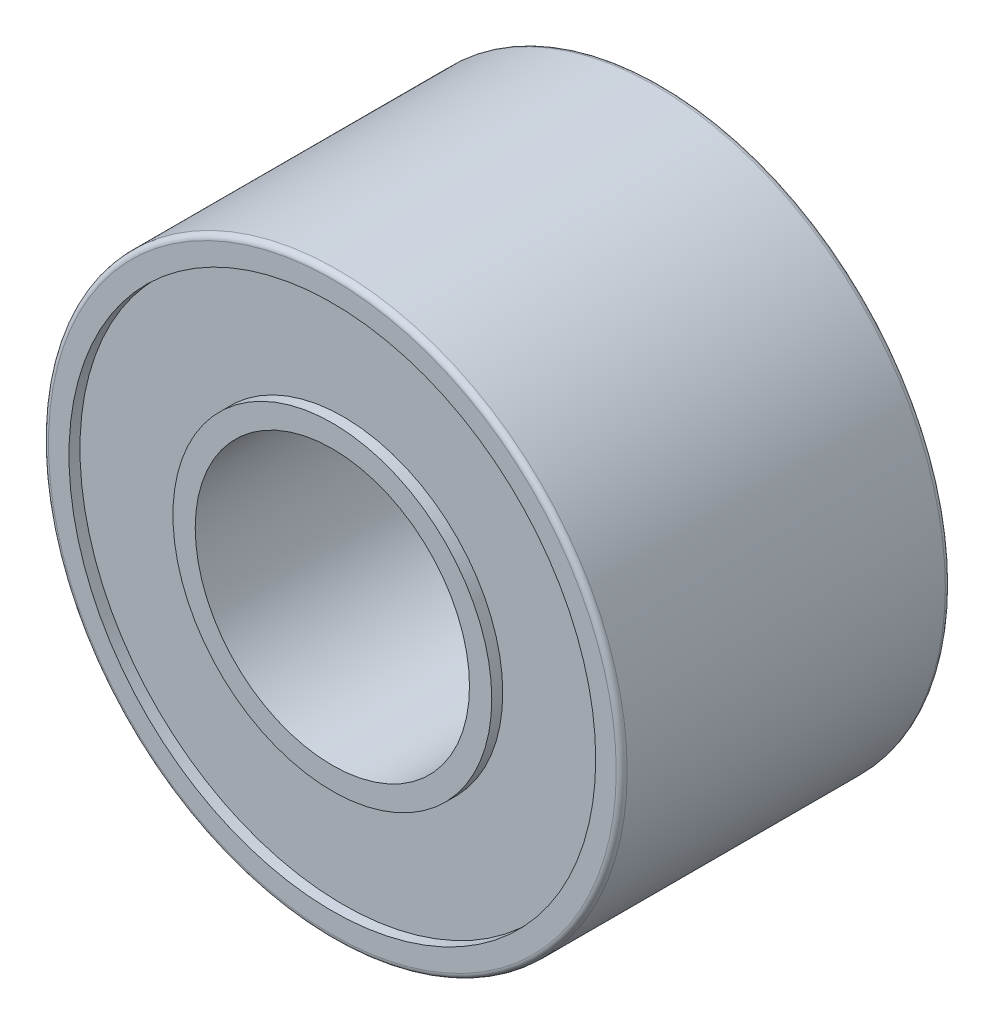
from build123d import *

# Parameters (mm, degrees)
SKETCH1_R           = 10.55
SKETCH1_R_2         = 5
BOSS_EXTRUDE1_DEPTH = 6
FILLET1_R           = 0.2
SKETCH3_R           = 9.602296017
SKETCH3_R_2         = 5.812916565
CUT_EXTRUDE1_DEPTH  = 0.4


with BuildPart() as part:
    # Sketch1 → Boss-Extrude1 (new, symmetric)
    with BuildSketch(Plane.XY):
        Circle(SKETCH1_R)
        Circle(SKETCH1_R_2, mode=Mode.SUBTRACT)
    extrude(amount=BOSS_EXTRUDE1_DEPTH, both=True)

    # Fillet1
    fillet1_edges = [part.edges().sort_by_distance(p)[0] for p in [
        (-10.55, 0, -6),
        (-10.55, 0, 6),
    ]]
    fillet(fillet1_edges, radius=FILLET1_R)

    # Sketch3 → Cut-Extrude1 (cut)
    with BuildSketch(Plane.XY.offset(6)):
        Circle(SKETCH3_R)
        Circle(SKETCH3_R_2, mode=Mode.SUBTRACT)
    cut_extrude1 = extrude(amount=-CUT_EXTRUDE1_DEPTH, mode=Mode.SUBTRACT)

    # Mirror1: Cut-Extrude1 across plane
    add(cut_extrude1.mirror(Plane.XY), mode=Mode.SUBTRACT)


solid = part.part
